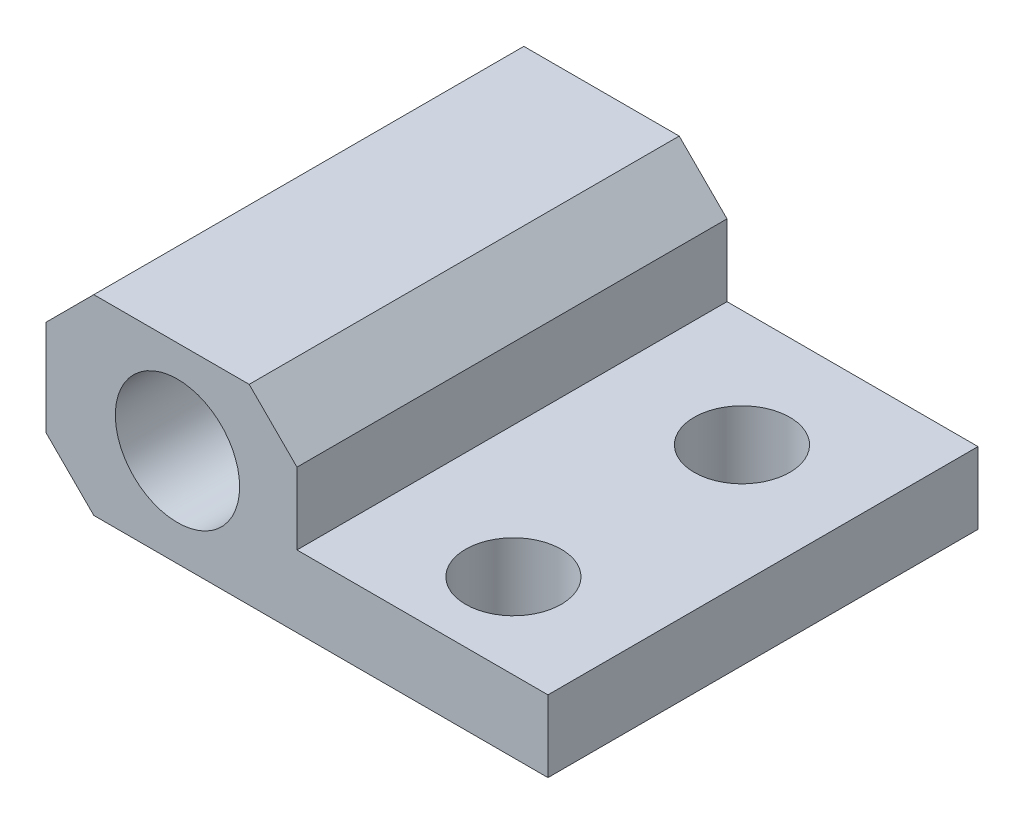
from build123d import *

# Parameters (mm, degrees)
SKETCH_1_W          = 21
SKETCH_1_H          = 17.990855805
EXTRUDE_1_DEPTH     = 8
SKETCH_2_W          = 10.499999995
SKETCH_2_H          = 17.994369167
CUT_EXTRUDE_1_DEPTH = 5
SKETCH_3_R          = 1.999999882
SKETCH_3_R_2        = 1.999999942
CUT_EXTRUDE_2_DEPTH = 22.671891763
SKETCH_4_R          = 2.6
CUT_EXTRUDE_3_DEPTH = 15
CHAMFER_1_SIZE      = 2


with BuildPart() as part:
    # Эскиз1 → Вытянуть1 (new body)
    with BuildSketch(Plane(origin=(0, 0, 0), x_dir=(1, 0, 0), z_dir=(0, 1, 0))):
        with Locations((-0.5, -8.995427903)):
            Rectangle(SKETCH_1_W, SKETCH_1_H)
    extrude(amount=EXTRUDE_1_DEPTH)

    # Эскиз2 → Вырез-Вытянуть1 (cut)
    with BuildSketch(Plane(origin=(0, 8, 0), x_dir=(1, 0, 0), z_dir=(0, 1, 0))):
        with Locations((4.749999998, -8.993671222)):
            Rectangle(SKETCH_2_W, SKETCH_2_H)
    extrude(amount=-CUT_EXTRUDE_1_DEPTH, mode=Mode.SUBTRACT)

    # Эскиз3 → Вырез-Вытянуть2 (cut, through all)
    with BuildSketch(Plane(origin=(0, 3, 0), x_dir=(1, 0, 0), z_dir=(0, 1, 0))):
        with Locations(Location((4.999999995, -14.436118586, 0), (0, 0, 270))):
            Circle(SKETCH_3_R)
        with Locations(Location((4.999999995, -4.873583798, 0), (0, 0, 270))):
            Circle(SKETCH_3_R_2)
    extrude(amount=-CUT_EXTRUDE_2_DEPTH, mode=Mode.SUBTRACT)

    # Эскиз4 → Вырез-Вытянуть3 (cut)
    with BuildSketch(Plane.XY.offset(17.990855805)):
        with Locations((-5.500000032, 4.090743194)):
            Circle(SKETCH_4_R)
    extrude(amount=-CUT_EXTRUDE_3_DEPTH, mode=Mode.SUBTRACT)

    # Фаска1
    chamfer_1_edges = [part.edges().sort_by_distance(p)[0] for p in [
        (-0.5, 8, 8.995427902),
        (-11, 8, 8.995427902),
        (-11, 0, 8.995427902),
    ]]
    chamfer(chamfer_1_edges, length=CHAMFER_1_SIZE)


solid = part.part
